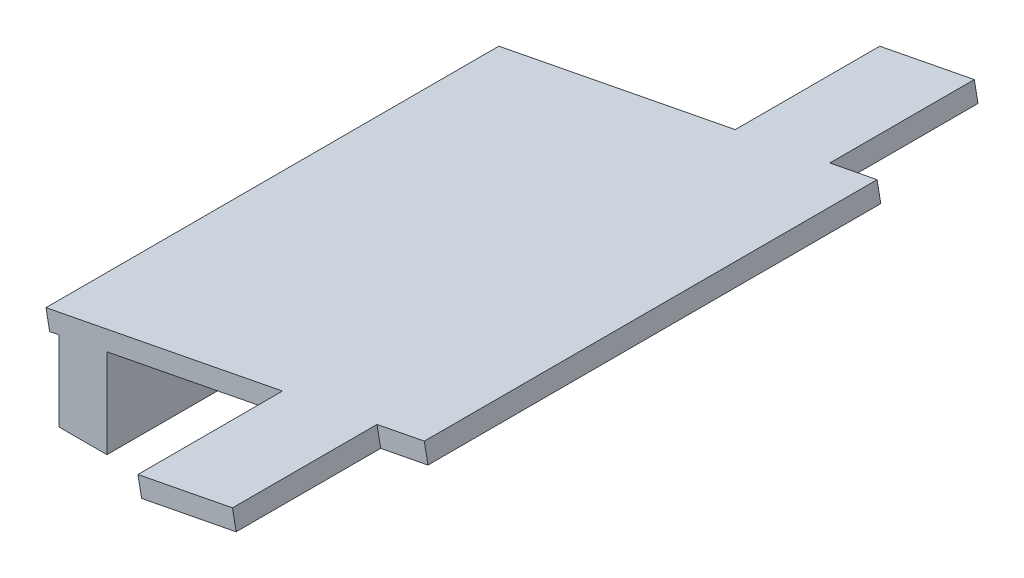
from build123d import *

# Parameters (mm, degrees)
SKETCH1_W             = 40
SKETCH1_H             = 47
BOSS_EXTRUDE1_DEPTH   = 2
BODY_MOVE_COPY1_ANGLE = 11
SKETCH2_W             = 5
SKETCH2_H             = 10
BOSS_EXTRUDE2_DEPTH   = 46.5
SKETCH4_W             = 10
SKETCH4_H             = 15
BOSS_EXTRUDE3_DEPTH   = 2
SKETCH5_W             = 10
SKETCH5_H             = 15
BOSS_EXTRUDE4_DEPTH   = 2


with BuildPart() as part:
    # Sketch1 → Boss-Extrude1 (new body)
    with BuildSketch(Plane(origin=(0, 0, 0), x_dir=(1, 0, 0), z_dir=(0, 1, 0))):
        with Locations((7.778638156, -0.723210277)):
            Rectangle(SKETCH1_W, SKETCH1_H)
    extrude(amount=BOSS_EXTRUDE1_DEPTH)


with BuildPart() as part_1:
    # Body-Move/Copy1: moved
    add(part.part.rotate(Axis((9.114441417, 1.5, 0), (0, 0, 1)), BODY_MOVE_COPY1_ANGLE))

    # Sketch2 → Boss-Extrude2 (add)
    with BuildSketch(Plane(origin=(0.351616414, 0, 24.223210277), x_dir=(1, 0, 0), z_dir=(0, 0, 1))):
        with Locations((-8.447854102, -7.138980591)):
            Rectangle(SKETCH2_W, SKETCH2_H)
    extrude(amount=-BOSS_EXTRUDE2_DEPTH)

    # Sketch4 → Boss-Extrude3 (add)
    with BuildSketch(Plane(origin=(-0.044520197, 0.229036558, 0), x_dir=(0.9816271834475203, 0.19080899537728402, 0), z_dir=(-0.190808995377284, 0.9816271834475203, 0))):
        with Locations((17.897393689, -31.723210277)):
            Rectangle(SKETCH4_W, SKETCH4_H)
    extrude(amount=-BOSS_EXTRUDE3_DEPTH)

    # Sketch5 → Boss-Extrude4 (add)
    with BuildSketch(Plane(origin=(-0.044520197, 0.229036558, 0), x_dir=(0.9816271834475203, 0.19080899537728402, 0), z_dir=(-0.190808995377284, 0.9816271834475203, 0))):
        with Locations((17.897393689, 30.276789723)):
            Rectangle(SKETCH5_W, SKETCH5_H)
    extrude(amount=-BOSS_EXTRUDE4_DEPTH)


solid = part_1.part
